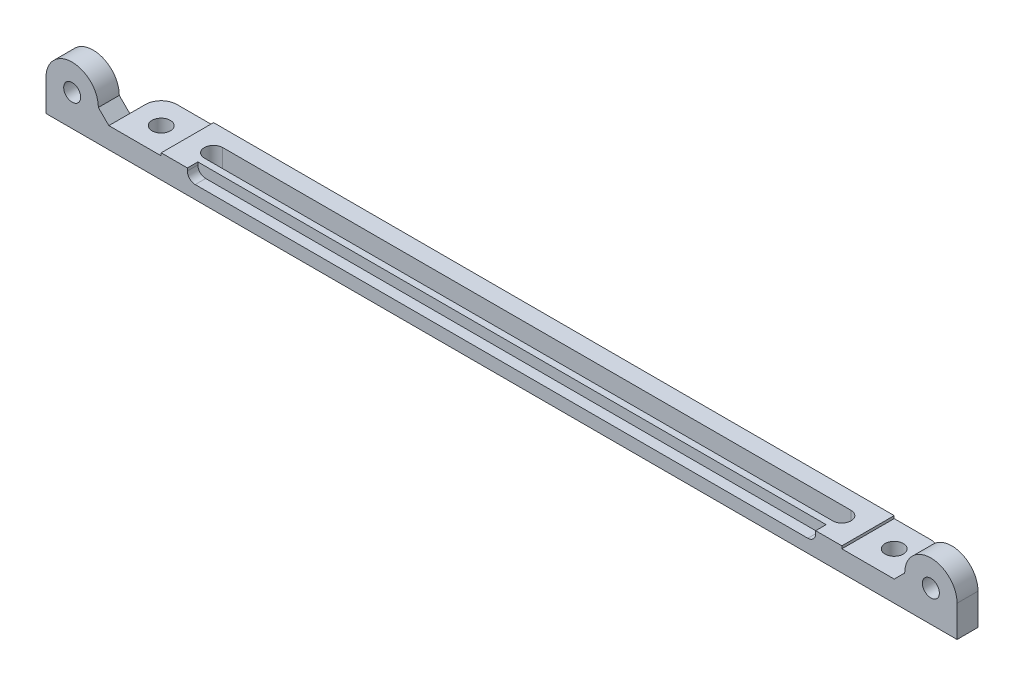
from build123d import *

# Parameters (mm, degrees)
SKETCH1_R           = 1.75
BOSS_EXTRUDE1_DEPTH = 4
SKETCH2_W           = 130
SKETCH2_H           = 10
BOSS_EXTRUDE2_DEPTH = 0.5
CUT_EXTRUDE1_DEPTH  = 2
SKETCH4_R           = 1.624205192
BOSS_EXTRUDE3_DEPTH = 4


with BuildPart() as part:
    # Sketch1 → Boss-Extrude1 (new body)
    with BuildSketch(Plane(origin=(0, 0, 0), x_dir=(1, 0, 0), z_dir=(0, 1, 0))):
        with BuildLine():
            ThreePointArc((75, 2), (74.121320344, 4.121320344), (72, 5))
            Line((72, 5), (-72, 5))
            ThreePointArc((-72, 5), (-74.121320344, 4.121320344), (-75, 2))
            Line((-75, 2), (-75, -5))
            Line((-75, -5), (75, -5))
            Line((75, -5), (75, 2))
        make_face()
        with Locations(Location((-70, 0, 0), (0, 0, 270))):
            Circle(SKETCH1_R, mode=Mode.SUBTRACT)
        with BuildLine():
            ThreePointArc((61.75, 0), (61.237436867, -1.237436867), (60, -1.75))
            Line((60, -1.75), (-60, -1.75))
            ThreePointArc((-60, -1.75), (-61.75, 0), (-60, 1.75))
            Line((-60, 1.75), (60, 1.75))
            ThreePointArc((60, 1.75), (61.237436867, 1.237436867), (61.75, 0))
        make_face(mode=Mode.SUBTRACT)
        with Locations(Location((70, 0, 0), (0, 0, 270))):
            Circle(SKETCH1_R, mode=Mode.SUBTRACT)
    extrude(amount=BOSS_EXTRUDE1_DEPTH)

    # Sketch2 → Boss-Extrude2 (add)
    with BuildSketch(Plane(origin=(0, 4, 0), x_dir=(1, 0, 0), z_dir=(0, 1, 0))):
        Rectangle(SKETCH2_W, SKETCH2_H)
        with BuildLine():
            Line((-60, 1.75), (60, 1.75))
            ThreePointArc((60, 1.75), (61.75, 0), (60, -1.75))
            Line((60, -1.75), (-60, -1.75))
            ThreePointArc((-60, -1.75), (-61.75, 0), (-60, 1.75))
        make_face(mode=Mode.SUBTRACT)
    extrude(amount=BOSS_EXTRUDE2_DEPTH)

    # Sketch3 → Cut-Extrude1 (cut)
    with BuildSketch(Plane.XY.offset(5)):
        with BuildLine():
            Line((58.5, 2.5), (-58.5, 2.5))
            ThreePointArc((-58.5, 2.5), (-59.560660172, 2.939339828), (-60, 4))
            Line((-60, 4), (-60, 4.5))
            Line((-60, 4.5), (60, 4.5))
            Line((60, 4.5), (60, 4))
            ThreePointArc((60, 4), (59.560660172, 2.939339828), (58.5, 2.5))
        make_face()
    extrude(amount=-CUT_EXTRUDE1_DEPTH, mode=Mode.SUBTRACT)

    # Sketch4 → Boss-Extrude3 (add)
    # profile 1 of 2: a face of its own
    with BuildSketch(Plane.XY.offset(5)):
        with BuildLine():
            Line((-75, 4), (-77, 6))
            ThreePointArc((-77, 6), (-82, 11), (-87, 6))
            Line((-87, 6), (-87, 0))
            Line((-87, 0), (-75, 0))
            Line((-75, 0), (-75, 4))
        make_face()
        with Locations((-82, 6)):
            Circle(SKETCH4_R, mode=Mode.SUBTRACT)
    # profile 2 of 2: a face of its own
    with BuildSketch(Plane.XY.offset(5)):
        with BuildLine():
            ThreePointArc((77, 6), (82, 11), (87, 6))
            Line((87, 6), (87, 0))
            Line((87, 0), (75, 0))
            Line((75, 0), (75, 4))
            Line((75, 4), (77, 6))
        make_face()
        with Locations((82, 6)):
            Circle(SKETCH4_R, mode=Mode.SUBTRACT)
    extrude(amount=-BOSS_EXTRUDE3_DEPTH)


solid = part.part
